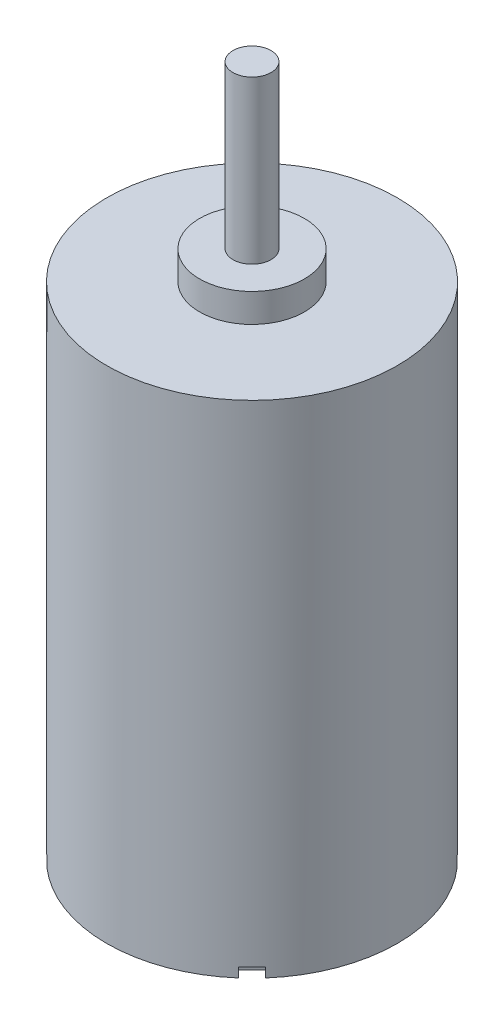
from build123d import *

# Parameters (mm, degrees)
CUT_EXTRUDE_START        = -0.2
CUT_EXTRUDE_1_DEPTH      = 0.2
PATTERN_CIRCULAR_1_COUNT = 4
SKETCH_2_3_R             = 0.25
CUT_EXTRUDE_2_DEPTH      = 0.2


with BuildPart() as part:
    # 草图1 → 旋转1 (revolve)
    with BuildSketch(Plane(origin=(0, 0, 0), x_dir=(0, 0, -1), z_dir=(1, 0, 0))):
        Polygon((0, 0), (3.05, 0), (3.05, 10.5), (1.1, 10.5), (1.1, 11.1), (0.4, 11.1), (0.4, 14.5), (0, 14.5), align=None)
    revolve(axis=Axis((0, 11.1, 0), (0, 1, 0)))

    # 草图2 → 切除-拉伸1 (cut)
    with BuildSketch(Plane.XZ.offset(CUT_EXTRUDE_START)):
        with BuildLine():
            Line((-2.152033922, 1.869191209), (-2.010612565, 2.010612565))
            Line((-2.010612565, 2.010612565), (-1.869191209, 2.152033922))
            Line((-1.869191209, 2.152033922), (-2.010612565, 2.293455278))
            ThreePointArc((-2.010612565, 2.293455278), (-2.156675683, 2.156675683), (-2.293455278, 2.010612565))
            Line((-2.293455278, 2.010612565), (-2.152033922, 1.869191209))
        make_face()
    cut_extrude_1 = extrude(amount=CUT_EXTRUDE_1_DEPTH, mode=Mode.SUBTRACT)

    # 阵列(圆周)1: 切除-拉伸1 ×4 about axis
    pattern_circular_1_axis = Axis((0, 11.1, 0), (0, -1, 0))
    for i in range(1, PATTERN_CIRCULAR_1_COUNT):
        add(cut_extrude_1.rotate(pattern_circular_1_axis, i * 360 / PATTERN_CIRCULAR_1_COUNT), mode=Mode.SUBTRACT)

    # 草图2<3> → 切除-拉伸2 (cut)
    with BuildSketch(Plane.XZ):
        with Locations((-2, 0)):
            Circle(SKETCH_2_3_R)
        with Locations((2, 0)):
            Circle(SKETCH_2_3_R)
    extrude(amount=-CUT_EXTRUDE_2_DEPTH, mode=Mode.SUBTRACT)


solid = part.part
